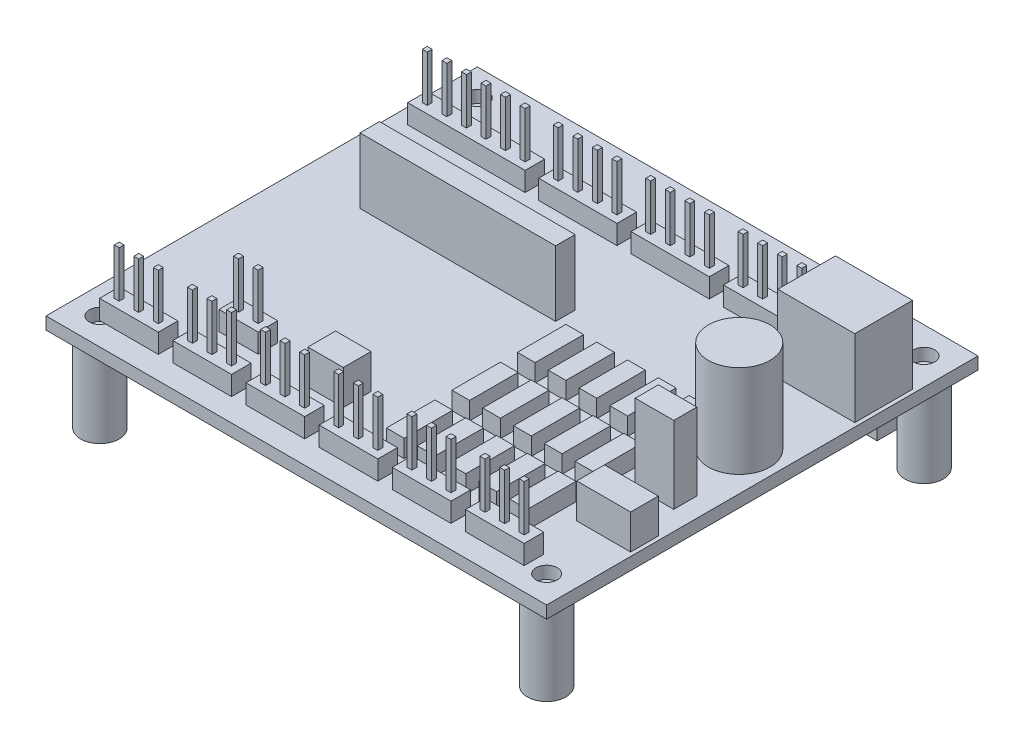
from build123d import *

# Parameters (mm, degrees)
SK_PCB_65X56_W                     = 65
SK_PCB_65X56_H                     = 56
SK_PCB_65X56_R                     = 1.375
PCB_65X56_DEPTH                    = 1.6
STANDOFFS_START                    = -11
SK_STANDOFFS_M2_5X11_R             = 2.5
STANDOFFS_M2_5X11_DEPTH            = 11
STANDOFFS_M2_5X11_2_DEPTH          = 11
STANDOFFS_M2_5X11_3_DEPTH          = 11
STANDOFFS_M2_5X11_4_DEPTH          = 11
GPIO_START                         = -8.5
SK_GPIO_FEMALE_HEADER_2X20_W       = 50.8
SK_GPIO_FEMALE_HEADER_2X20_H       = 5.1
GPIO_FEMALE_HEADER_2X20_DEPTH      = 8.5
BACK_START                         = 1.6
SK_BACK_HEADERS_J2_J6_J10_W        = 7.62
SK_BACK_HEADERS_J2_J6_J10_H        = 2.54
BACK_HEADERS_J2_J6_J10_DEPTH       = 2.5
BACK_HEADERS_J2_J6_J10_2_DEPTH     = 2.5
BACK_HEADERS_J2_J6_J10_3_DEPTH     = 2.5
BACK_HEADERS_J2_J6_J10_4_DEPTH     = 2.5
BACK_HEADERS_J2_J6_J10_5_DEPTH     = 2.5
BACK_HEADERS_J2_J6_J10_6_DEPTH     = 2.5
BACK_START_2                       = 4.1
SK_BACK_HEADER_PINS_W              = 0.64
SK_BACK_HEADER_PINS_H              = 0.64
BACK_HEADER_PINS_DEPTH             = 6
BACK_HEADER_PINS_2_DEPTH           = 6
BACK_HEADER_PINS_3_DEPTH           = 6
BACK_HEADER_PINS_4_DEPTH           = 6
BACK_HEADER_PINS_5_DEPTH           = 6
BACK_HEADER_PINS_6_DEPTH           = 6
BACK_HEADER_PINS_7_DEPTH           = 6
BACK_HEADER_PINS_8_DEPTH           = 6
BACK_HEADER_PINS_9_DEPTH           = 6
BACK_HEADER_PINS_10_DEPTH          = 6
BACK_HEADER_PINS_11_DEPTH          = 6
BACK_HEADER_PINS_12_DEPTH          = 6
BACK_HEADER_PINS_13_DEPTH          = 6
BACK_HEADER_PINS_14_DEPTH          = 6
BACK_HEADER_PINS_15_DEPTH          = 6
BACK_HEADER_PINS_16_DEPTH          = 6
BACK_HEADER_PINS_17_DEPTH          = 6
BACK_HEADER_PINS_18_DEPTH          = 6
FRONT_START                        = 1.6
SK_FRONT_HEADERS_J7_J8_J9_J11_W    = 15.24
SK_FRONT_HEADERS_J7_J8_J9_J11_H    = 2.54
FRONT_HEADERS_J7_J8_J9_J11_DEPTH   = 2.5
SK_FRONT_HEADERS_J7_J8_J9_J11_W_2  = 10.16
FRONT_HEADERS_J7_J8_J9_J11_2_DEPTH = 2.5
FRONT_HEADERS_J7_J8_J9_J11_3_DEPTH = 2.5
FRONT_HEADERS_J7_J8_J9_J11_4_DEPTH = 2.5
SK_FRONT_HEADERS_J7_J8_J9_J11_W_3  = 5.08
FRONT_HEADERS_J7_J8_J9_J11_5_DEPTH = 2.5
FRONT_START_2                      = 4.1
SK_FRONT_HEADER_PINS_W             = 0.64
SK_FRONT_HEADER_PINS_H             = 0.64
FRONT_HEADER_PINS_DEPTH            = 6
FRONT_HEADER_PINS_2_DEPTH          = 6
FRONT_HEADER_PINS_3_DEPTH          = 6
FRONT_HEADER_PINS_4_DEPTH          = 6
FRONT_HEADER_PINS_5_DEPTH          = 6
FRONT_HEADER_PINS_6_DEPTH          = 6
FRONT_HEADER_PINS_7_DEPTH          = 6
FRONT_HEADER_PINS_8_DEPTH          = 6
FRONT_HEADER_PINS_9_DEPTH          = 6
FRONT_HEADER_PINS_10_DEPTH         = 6
FRONT_HEADER_PINS_11_DEPTH         = 6
FRONT_HEADER_PINS_12_DEPTH         = 6
FRONT_HEADER_PINS_13_DEPTH         = 6
FRONT_HEADER_PINS_14_DEPTH         = 6
FRONT_HEADER_PINS_15_DEPTH         = 6
FRONT_HEADER_PINS_16_DEPTH         = 6
FRONT_HEADER_PINS_17_DEPTH         = 6
FRONT_HEADER_PINS_18_DEPTH         = 6
FRONT_HEADER_PINS_19_DEPTH         = 6
FRONT_HEADER_PINS_20_DEPTH         = 6
J1_START                           = 1.6
SK_J1_5V_SCREW_TERMINAL_W          = 10
SK_J1_5V_SCREW_TERMINAL_H          = 7.5
J1_5V_SCREW_TERMINAL_DEPTH         = 10
ADS1115_START                      = 1.6
SK_ADS1115_SOCKET_1X10_W           = 25.4
SK_ADS1115_SOCKET_1X10_H           = 2.54
ADS1115_SOCKET_1X10_DEPTH          = 8.5
RESISTORS_START                    = 1.6
SK_RESISTORS_R1_R15_W              = 2.3
SK_RESISTORS_R1_R15_H              = 6.3
RESISTORS_R1_R15_DEPTH             = 2.3
RESISTORS_R1_R15_2_DEPTH           = 2.3
RESISTORS_R1_R15_3_DEPTH           = 2.3
RESISTORS_R1_R15_4_DEPTH           = 2.3
RESISTORS_R1_R15_5_DEPTH           = 2.3
RESISTORS_R1_R15_6_DEPTH           = 2.3
RESISTORS_R1_R15_7_DEPTH           = 2.3
RESISTORS_R1_R15_8_DEPTH           = 2.3
RESISTORS_R1_R15_9_DEPTH           = 2.3
RESISTORS_R1_R15_10_DEPTH          = 2.3
RESISTORS_R1_R15_11_DEPTH          = 2.3
RESISTORS_R1_R15_12_DEPTH          = 2.3
RESISTORS_R1_R15_13_DEPTH          = 2.3
RESISTORS_R1_R15_14_DEPTH          = 2.3
RESISTORS_R1_R15_15_DEPTH          = 2.3
C1_START                           = 1.6
SK_C1_470UF_R                      = 4
C1_470UF_DEPTH                     = 12
F1_START                           = 1.6
SK_F1_PTC_2_5A_W                   = 5
SK_F1_PTC_2_5A_H                   = 3
F1_PTC_2_5A_DEPTH                  = 10
D1_START                           = 1.6
SK_D1_TVS_AND_Q1_BC557_W           = 7
SK_D1_TVS_AND_Q1_BC557_H           = 3.6
D1_TVS_AND_Q1_BC557_DEPTH          = 4.5
SK_D1_TVS_AND_Q1_BC557_W_2         = 4.6
D1_TVS_AND_Q1_BC557_2_DEPTH        = 4.5


with BuildPart() as part:
    # SK PCB 65x56 → PCB 65x56 (new body)
    with BuildSketch(Plane(origin=(0, 0, 0), x_dir=(1, 0, 0), z_dir=(0, 1, 0))):
        with Locations((32.5, 28)):
            Rectangle(SK_PCB_65X56_W, SK_PCB_65X56_H)
        with Locations(Location((3.5, 3.5, 0), (0, 0, 270))):
            Circle(SK_PCB_65X56_R, mode=Mode.SUBTRACT)
        with Locations(Location((61.5, 3.5, 0), (0, 0, 270))):
            Circle(SK_PCB_65X56_R, mode=Mode.SUBTRACT)
        with Locations(Location((3.5, 52.5, 0), (0, 0, 270))):
            Circle(SK_PCB_65X56_R, mode=Mode.SUBTRACT)
        with Locations(Location((61.5, 52.5, 0), (0, 0, 270))):
            Circle(SK_PCB_65X56_R, mode=Mode.SUBTRACT)
    extrude(amount=PCB_65X56_DEPTH)


with BuildPart() as body_2:
    # SK Standoffs M2.5x11 → Standoffs M2.5x11 (new body)
    with BuildSketch(Plane(origin=(0, 0, 0), x_dir=(1, 0, 0), z_dir=(0, 1, 0)).offset(STANDOFFS_START)):
        with Locations(Location((3.5, 3.5, 0), (0, 0, 270))):
            Circle(SK_STANDOFFS_M2_5X11_R)
    extrude(amount=STANDOFFS_M2_5X11_DEPTH)


with BuildPart() as body_3:
    # SK Standoffs M2.5x11 → Standoffs M2.5x11 2 (new body)
    with BuildSketch(Plane(origin=(0, 0, 0), x_dir=(1, 0, 0), z_dir=(0, 1, 0)).offset(STANDOFFS_START)):
        with Locations(Location((61.5, 3.5, 0), (0, 0, 270))):
            Circle(SK_STANDOFFS_M2_5X11_R)
    extrude(amount=STANDOFFS_M2_5X11_2_DEPTH)


with BuildPart() as body_4:
    # SK Standoffs M2.5x11 → Standoffs M2.5x11 3 (new body)
    with BuildSketch(Plane(origin=(0, 0, 0), x_dir=(1, 0, 0), z_dir=(0, 1, 0)).offset(STANDOFFS_START)):
        with Locations(Location((3.5, 52.5, 0), (0, 0, 270))):
            Circle(SK_STANDOFFS_M2_5X11_R)
    extrude(amount=STANDOFFS_M2_5X11_3_DEPTH)


with BuildPart() as body_5:
    # SK Standoffs M2.5x11 → Standoffs M2.5x11 4 (new body)
    with BuildSketch(Plane(origin=(0, 0, 0), x_dir=(1, 0, 0), z_dir=(0, 1, 0)).offset(STANDOFFS_START)):
        with Locations(Location((61.5, 52.5, 0), (0, 0, 270))):
            Circle(SK_STANDOFFS_M2_5X11_R)
    extrude(amount=STANDOFFS_M2_5X11_4_DEPTH)


with BuildPart() as body_6:
    # SK GPIO female header 2x20 → GPIO female header 2x20 (new body)
    with BuildSketch(Plane(origin=(0, 0, 0), x_dir=(1, 0, 0), z_dir=(0, 1, 0)).offset(GPIO_START)):
        with Locations((32.5, 52.55)):
            Rectangle(SK_GPIO_FEMALE_HEADER_2X20_W, SK_GPIO_FEMALE_HEADER_2X20_H)
    extrude(amount=GPIO_FEMALE_HEADER_2X20_DEPTH)


with BuildPart() as body_7:
    # SK Back headers J2-J6 J10 → Back headers J2-J6 J10 (new body)
    with BuildSketch(Plane(origin=(0, 0, 0), x_dir=(1, 0, 0), z_dir=(0, 1, 0)).offset(BACK_START)):
        with Locations((7.81, 4.23)):
            Rectangle(SK_BACK_HEADERS_J2_J6_J10_W, SK_BACK_HEADERS_J2_J6_J10_H)
    extrude(amount=BACK_HEADERS_J2_J6_J10_DEPTH)


with BuildPart() as body_8:
    # SK Back headers J2-J6 J10 → Back headers J2-J6 J10 2 (new body)
    with BuildSketch(Plane(origin=(0, 0, 0), x_dir=(1, 0, 0), z_dir=(0, 1, 0)).offset(BACK_START)):
        with Locations((17.31, 4.23)):
            Rectangle(SK_BACK_HEADERS_J2_J6_J10_W, SK_BACK_HEADERS_J2_J6_J10_H)
    extrude(amount=BACK_HEADERS_J2_J6_J10_2_DEPTH)


with BuildPart() as body_9:
    # SK Back headers J2-J6 J10 → Back headers J2-J6 J10 3 (new body)
    with BuildSketch(Plane(origin=(0, 0, 0), x_dir=(1, 0, 0), z_dir=(0, 1, 0)).offset(BACK_START)):
        with Locations((26.81, 4.23)):
            Rectangle(SK_BACK_HEADERS_J2_J6_J10_W, SK_BACK_HEADERS_J2_J6_J10_H)
    extrude(amount=BACK_HEADERS_J2_J6_J10_3_DEPTH)


with BuildPart() as body_10:
    # SK Back headers J2-J6 J10 → Back headers J2-J6 J10 4 (new body)
    with BuildSketch(Plane(origin=(0, 0, 0), x_dir=(1, 0, 0), z_dir=(0, 1, 0)).offset(BACK_START)):
        with Locations((36.31, 4.23)):
            Rectangle(SK_BACK_HEADERS_J2_J6_J10_W, SK_BACK_HEADERS_J2_J6_J10_H)
    extrude(amount=BACK_HEADERS_J2_J6_J10_4_DEPTH)


with BuildPart() as body_11:
    # SK Back headers J2-J6 J10 → Back headers J2-J6 J10 5 (new body)
    with BuildSketch(Plane(origin=(0, 0, 0), x_dir=(1, 0, 0), z_dir=(0, 1, 0)).offset(BACK_START)):
        with Locations((45.81, 4.23)):
            Rectangle(SK_BACK_HEADERS_J2_J6_J10_W, SK_BACK_HEADERS_J2_J6_J10_H)
    extrude(amount=BACK_HEADERS_J2_J6_J10_5_DEPTH)


with BuildPart() as body_12:
    # SK Back headers J2-J6 J10 → Back headers J2-J6 J10 6 (new body)
    with BuildSketch(Plane(origin=(0, 0, 0), x_dir=(1, 0, 0), z_dir=(0, 1, 0)).offset(BACK_START)):
        with Locations((55.31, 4.23)):
            Rectangle(SK_BACK_HEADERS_J2_J6_J10_W, SK_BACK_HEADERS_J2_J6_J10_H)
    extrude(amount=BACK_HEADERS_J2_J6_J10_6_DEPTH)


with BuildPart() as body_13:
    # SK Back header pins → Back header pins (new body)
    with BuildSketch(Plane(origin=(0, 0, 0), x_dir=(1, 0, 0), z_dir=(0, 1, 0)).offset(BACK_START_2)):
        with Locations((5.27, 4.23)):
            Rectangle(SK_BACK_HEADER_PINS_W, SK_BACK_HEADER_PINS_H)
    extrude(amount=BACK_HEADER_PINS_DEPTH)


with BuildPart() as body_14:
    # SK Back header pins → Back header pins 2 (new body)
    with BuildSketch(Plane(origin=(0, 0, 0), x_dir=(1, 0, 0), z_dir=(0, 1, 0)).offset(BACK_START_2)):
        with Locations((7.81, 4.23)):
            Rectangle(SK_BACK_HEADER_PINS_W, SK_BACK_HEADER_PINS_H)
    extrude(amount=BACK_HEADER_PINS_2_DEPTH)


with BuildPart() as body_15:
    # SK Back header pins → Back header pins 3 (new body)
    with BuildSketch(Plane(origin=(0, 0, 0), x_dir=(1, 0, 0), z_dir=(0, 1, 0)).offset(BACK_START_2)):
        with Locations((10.35, 4.23)):
            Rectangle(SK_BACK_HEADER_PINS_W, SK_BACK_HEADER_PINS_H)
    extrude(amount=BACK_HEADER_PINS_3_DEPTH)


with BuildPart() as body_16:
    # SK Back header pins → Back header pins 4 (new body)
    with BuildSketch(Plane(origin=(0, 0, 0), x_dir=(1, 0, 0), z_dir=(0, 1, 0)).offset(BACK_START_2)):
        with Locations((14.77, 4.23)):
            Rectangle(SK_BACK_HEADER_PINS_W, SK_BACK_HEADER_PINS_H)
    extrude(amount=BACK_HEADER_PINS_4_DEPTH)


with BuildPart() as body_17:
    # SK Back header pins → Back header pins 5 (new body)
    with BuildSketch(Plane(origin=(0, 0, 0), x_dir=(1, 0, 0), z_dir=(0, 1, 0)).offset(BACK_START_2)):
        with Locations((17.31, 4.23)):
            Rectangle(SK_BACK_HEADER_PINS_W, SK_BACK_HEADER_PINS_H)
    extrude(amount=BACK_HEADER_PINS_5_DEPTH)


with BuildPart() as body_18:
    # SK Back header pins → Back header pins 6 (new body)
    with BuildSketch(Plane(origin=(0, 0, 0), x_dir=(1, 0, 0), z_dir=(0, 1, 0)).offset(BACK_START_2)):
        with Locations((19.85, 4.23)):
            Rectangle(SK_BACK_HEADER_PINS_W, SK_BACK_HEADER_PINS_H)
    extrude(amount=BACK_HEADER_PINS_6_DEPTH)


with BuildPart() as body_19:
    # SK Back header pins → Back header pins 7 (new body)
    with BuildSketch(Plane(origin=(0, 0, 0), x_dir=(1, 0, 0), z_dir=(0, 1, 0)).offset(BACK_START_2)):
        with Locations((24.27, 4.23)):
            Rectangle(SK_BACK_HEADER_PINS_W, SK_BACK_HEADER_PINS_H)
    extrude(amount=BACK_HEADER_PINS_7_DEPTH)


with BuildPart() as body_20:
    # SK Back header pins → Back header pins 8 (new body)
    with BuildSketch(Plane(origin=(0, 0, 0), x_dir=(1, 0, 0), z_dir=(0, 1, 0)).offset(BACK_START_2)):
        with Locations((26.81, 4.23)):
            Rectangle(SK_BACK_HEADER_PINS_W, SK_BACK_HEADER_PINS_H)
    extrude(amount=BACK_HEADER_PINS_8_DEPTH)


with BuildPart() as body_21:
    # SK Back header pins → Back header pins 9 (new body)
    with BuildSketch(Plane(origin=(0, 0, 0), x_dir=(1, 0, 0), z_dir=(0, 1, 0)).offset(BACK_START_2)):
        with Locations((29.35, 4.23)):
            Rectangle(SK_BACK_HEADER_PINS_W, SK_BACK_HEADER_PINS_H)
    extrude(amount=BACK_HEADER_PINS_9_DEPTH)


with BuildPart() as body_22:
    # SK Back header pins → Back header pins 10 (new body)
    with BuildSketch(Plane(origin=(0, 0, 0), x_dir=(1, 0, 0), z_dir=(0, 1, 0)).offset(BACK_START_2)):
        with Locations((33.77, 4.23)):
            Rectangle(SK_BACK_HEADER_PINS_W, SK_BACK_HEADER_PINS_H)
    extrude(amount=BACK_HEADER_PINS_10_DEPTH)


with BuildPart() as body_23:
    # SK Back header pins → Back header pins 11 (new body)
    with BuildSketch(Plane(origin=(0, 0, 0), x_dir=(1, 0, 0), z_dir=(0, 1, 0)).offset(BACK_START_2)):
        with Locations((36.31, 4.23)):
            Rectangle(SK_BACK_HEADER_PINS_W, SK_BACK_HEADER_PINS_H)
    extrude(amount=BACK_HEADER_PINS_11_DEPTH)


with BuildPart() as body_24:
    # SK Back header pins → Back header pins 12 (new body)
    with BuildSketch(Plane(origin=(0, 0, 0), x_dir=(1, 0, 0), z_dir=(0, 1, 0)).offset(BACK_START_2)):
        with Locations((38.85, 4.23)):
            Rectangle(SK_BACK_HEADER_PINS_W, SK_BACK_HEADER_PINS_H)
    extrude(amount=BACK_HEADER_PINS_12_DEPTH)


with BuildPart() as body_25:
    # SK Back header pins → Back header pins 13 (new body)
    with BuildSketch(Plane(origin=(0, 0, 0), x_dir=(1, 0, 0), z_dir=(0, 1, 0)).offset(BACK_START_2)):
        with Locations((43.27, 4.23)):
            Rectangle(SK_BACK_HEADER_PINS_W, SK_BACK_HEADER_PINS_H)
    extrude(amount=BACK_HEADER_PINS_13_DEPTH)


with BuildPart() as body_26:
    # SK Back header pins → Back header pins 14 (new body)
    with BuildSketch(Plane(origin=(0, 0, 0), x_dir=(1, 0, 0), z_dir=(0, 1, 0)).offset(BACK_START_2)):
        with Locations((45.81, 4.23)):
            Rectangle(SK_BACK_HEADER_PINS_W, SK_BACK_HEADER_PINS_H)
    extrude(amount=BACK_HEADER_PINS_14_DEPTH)


with BuildPart() as body_27:
    # SK Back header pins → Back header pins 15 (new body)
    with BuildSketch(Plane(origin=(0, 0, 0), x_dir=(1, 0, 0), z_dir=(0, 1, 0)).offset(BACK_START_2)):
        with Locations((48.35, 4.23)):
            Rectangle(SK_BACK_HEADER_PINS_W, SK_BACK_HEADER_PINS_H)
    extrude(amount=BACK_HEADER_PINS_15_DEPTH)


with BuildPart() as body_28:
    # SK Back header pins → Back header pins 16 (new body)
    with BuildSketch(Plane(origin=(0, 0, 0), x_dir=(1, 0, 0), z_dir=(0, 1, 0)).offset(BACK_START_2)):
        with Locations((52.77, 4.23)):
            Rectangle(SK_BACK_HEADER_PINS_W, SK_BACK_HEADER_PINS_H)
    extrude(amount=BACK_HEADER_PINS_16_DEPTH)


with BuildPart() as body_29:
    # SK Back header pins → Back header pins 17 (new body)
    with BuildSketch(Plane(origin=(0, 0, 0), x_dir=(1, 0, 0), z_dir=(0, 1, 0)).offset(BACK_START_2)):
        with Locations((55.31, 4.23)):
            Rectangle(SK_BACK_HEADER_PINS_W, SK_BACK_HEADER_PINS_H)
    extrude(amount=BACK_HEADER_PINS_17_DEPTH)


with BuildPart() as body_30:
    # SK Back header pins → Back header pins 18 (new body)
    with BuildSketch(Plane(origin=(0, 0, 0), x_dir=(1, 0, 0), z_dir=(0, 1, 0)).offset(BACK_START_2)):
        with Locations((57.85, 4.23)):
            Rectangle(SK_BACK_HEADER_PINS_W, SK_BACK_HEADER_PINS_H)
    extrude(amount=BACK_HEADER_PINS_18_DEPTH)


with BuildPart() as body_31:
    # SK Front headers J7 J8 J9 J11 → Front headers J7 J8 J9 J11 (new body)
    with BuildSketch(Plane(origin=(0, 0, 0), x_dir=(1, 0, 0), z_dir=(0, 1, 0)).offset(FRONT_START)):
        with Locations((9.62, 46.23)):
            Rectangle(SK_FRONT_HEADERS_J7_J8_J9_J11_W, SK_FRONT_HEADERS_J7_J8_J9_J11_H)
    extrude(amount=FRONT_HEADERS_J7_J8_J9_J11_DEPTH)


with BuildPart() as body_32:
    # SK Front headers J7 J8 J9 J11 → Front headers J7 J8 J9 J11 2 (new body)
    with BuildSketch(Plane(origin=(0, 0, 0), x_dir=(1, 0, 0), z_dir=(0, 1, 0)).offset(FRONT_START)):
        with Locations((24.08, 46.23)):
            Rectangle(SK_FRONT_HEADERS_J7_J8_J9_J11_W_2, SK_FRONT_HEADERS_J7_J8_J9_J11_H)
    extrude(amount=FRONT_HEADERS_J7_J8_J9_J11_2_DEPTH)


with BuildPart() as body_33:
    # SK Front headers J7 J8 J9 J11 → Front headers J7 J8 J9 J11 3 (new body)
    with BuildSketch(Plane(origin=(0, 0, 0), x_dir=(1, 0, 0), z_dir=(0, 1, 0)).offset(FRONT_START)):
        with Locations((36.08, 46.23)):
            Rectangle(SK_FRONT_HEADERS_J7_J8_J9_J11_W_2, SK_FRONT_HEADERS_J7_J8_J9_J11_H)
    extrude(amount=FRONT_HEADERS_J7_J8_J9_J11_3_DEPTH)


with BuildPart() as body_34:
    # SK Front headers J7 J8 J9 J11 → Front headers J7 J8 J9 J11 4 (new body)
    with BuildSketch(Plane(origin=(0, 0, 0), x_dir=(1, 0, 0), z_dir=(0, 1, 0)).offset(FRONT_START)):
        with Locations((48.08, 46.23)):
            Rectangle(SK_FRONT_HEADERS_J7_J8_J9_J11_W_2, SK_FRONT_HEADERS_J7_J8_J9_J11_H)
    extrude(amount=FRONT_HEADERS_J7_J8_J9_J11_4_DEPTH)


with BuildPart() as body_35:
    # SK Front headers J7 J8 J9 J11 → Front headers J7 J8 J9 J11 5 (new body)
    with BuildSketch(Plane(origin=(0, 0, 0), x_dir=(1, 0, 0), z_dir=(0, 1, 0)).offset(FRONT_START)):
        with Locations((15.54, 10.73)):
            Rectangle(SK_FRONT_HEADERS_J7_J8_J9_J11_W_3, SK_FRONT_HEADERS_J7_J8_J9_J11_H)
    extrude(amount=FRONT_HEADERS_J7_J8_J9_J11_5_DEPTH)


with BuildPart() as body_36:
    # SK Front header pins → Front header pins (new body)
    with BuildSketch(Plane(origin=(0, 0, 0), x_dir=(1, 0, 0), z_dir=(0, 1, 0)).offset(FRONT_START_2)):
        with Locations((3.27, 46.23)):
            Rectangle(SK_FRONT_HEADER_PINS_W, SK_FRONT_HEADER_PINS_H)
    extrude(amount=FRONT_HEADER_PINS_DEPTH)


with BuildPart() as body_37:
    # SK Front header pins → Front header pins 2 (new body)
    with BuildSketch(Plane(origin=(0, 0, 0), x_dir=(1, 0, 0), z_dir=(0, 1, 0)).offset(FRONT_START_2)):
        with Locations((5.81, 46.23)):
            Rectangle(SK_FRONT_HEADER_PINS_W, SK_FRONT_HEADER_PINS_H)
    extrude(amount=FRONT_HEADER_PINS_2_DEPTH)


with BuildPart() as body_38:
    # SK Front header pins → Front header pins 3 (new body)
    with BuildSketch(Plane(origin=(0, 0, 0), x_dir=(1, 0, 0), z_dir=(0, 1, 0)).offset(FRONT_START_2)):
        with Locations((8.35, 46.23)):
            Rectangle(SK_FRONT_HEADER_PINS_W, SK_FRONT_HEADER_PINS_H)
    extrude(amount=FRONT_HEADER_PINS_3_DEPTH)


with BuildPart() as body_39:
    # SK Front header pins → Front header pins 4 (new body)
    with BuildSketch(Plane(origin=(0, 0, 0), x_dir=(1, 0, 0), z_dir=(0, 1, 0)).offset(FRONT_START_2)):
        with Locations((10.89, 46.23)):
            Rectangle(SK_FRONT_HEADER_PINS_W, SK_FRONT_HEADER_PINS_H)
    extrude(amount=FRONT_HEADER_PINS_4_DEPTH)


with BuildPart() as body_40:
    # SK Front header pins → Front header pins 5 (new body)
    with BuildSketch(Plane(origin=(0, 0, 0), x_dir=(1, 0, 0), z_dir=(0, 1, 0)).offset(FRONT_START_2)):
        with Locations((13.43, 46.23)):
            Rectangle(SK_FRONT_HEADER_PINS_W, SK_FRONT_HEADER_PINS_H)
    extrude(amount=FRONT_HEADER_PINS_5_DEPTH)


with BuildPart() as body_41:
    # SK Front header pins → Front header pins 6 (new body)
    with BuildSketch(Plane(origin=(0, 0, 0), x_dir=(1, 0, 0), z_dir=(0, 1, 0)).offset(FRONT_START_2)):
        with Locations((15.97, 46.23)):
            Rectangle(SK_FRONT_HEADER_PINS_W, SK_FRONT_HEADER_PINS_H)
    extrude(amount=FRONT_HEADER_PINS_6_DEPTH)


with BuildPart() as body_42:
    # SK Front header pins → Front header pins 7 (new body)
    with BuildSketch(Plane(origin=(0, 0, 0), x_dir=(1, 0, 0), z_dir=(0, 1, 0)).offset(FRONT_START_2)):
        with Locations((20.27, 46.23)):
            Rectangle(SK_FRONT_HEADER_PINS_W, SK_FRONT_HEADER_PINS_H)
    extrude(amount=FRONT_HEADER_PINS_7_DEPTH)


with BuildPart() as body_43:
    # SK Front header pins → Front header pins 8 (new body)
    with BuildSketch(Plane(origin=(0, 0, 0), x_dir=(1, 0, 0), z_dir=(0, 1, 0)).offset(FRONT_START_2)):
        with Locations((22.81, 46.23)):
            Rectangle(SK_FRONT_HEADER_PINS_W, SK_FRONT_HEADER_PINS_H)
    extrude(amount=FRONT_HEADER_PINS_8_DEPTH)


with BuildPart() as body_44:
    # SK Front header pins → Front header pins 9 (new body)
    with BuildSketch(Plane(origin=(0, 0, 0), x_dir=(1, 0, 0), z_dir=(0, 1, 0)).offset(FRONT_START_2)):
        with Locations((25.35, 46.23)):
            Rectangle(SK_FRONT_HEADER_PINS_W, SK_FRONT_HEADER_PINS_H)
    extrude(amount=FRONT_HEADER_PINS_9_DEPTH)


with BuildPart() as body_45:
    # SK Front header pins → Front header pins 10 (new body)
    with BuildSketch(Plane(origin=(0, 0, 0), x_dir=(1, 0, 0), z_dir=(0, 1, 0)).offset(FRONT_START_2)):
        with Locations((27.89, 46.23)):
            Rectangle(SK_FRONT_HEADER_PINS_W, SK_FRONT_HEADER_PINS_H)
    extrude(amount=FRONT_HEADER_PINS_10_DEPTH)


with BuildPart() as body_46:
    # SK Front header pins → Front header pins 11 (new body)
    with BuildSketch(Plane(origin=(0, 0, 0), x_dir=(1, 0, 0), z_dir=(0, 1, 0)).offset(FRONT_START_2)):
        with Locations((32.27, 46.23)):
            Rectangle(SK_FRONT_HEADER_PINS_W, SK_FRONT_HEADER_PINS_H)
    extrude(amount=FRONT_HEADER_PINS_11_DEPTH)


with BuildPart() as body_47:
    # SK Front header pins → Front header pins 12 (new body)
    with BuildSketch(Plane(origin=(0, 0, 0), x_dir=(1, 0, 0), z_dir=(0, 1, 0)).offset(FRONT_START_2)):
        with Locations((34.81, 46.23)):
            Rectangle(SK_FRONT_HEADER_PINS_W, SK_FRONT_HEADER_PINS_H)
    extrude(amount=FRONT_HEADER_PINS_12_DEPTH)


with BuildPart() as body_48:
    # SK Front header pins → Front header pins 13 (new body)
    with BuildSketch(Plane(origin=(0, 0, 0), x_dir=(1, 0, 0), z_dir=(0, 1, 0)).offset(FRONT_START_2)):
        with Locations((37.35, 46.23)):
            Rectangle(SK_FRONT_HEADER_PINS_W, SK_FRONT_HEADER_PINS_H)
    extrude(amount=FRONT_HEADER_PINS_13_DEPTH)


with BuildPart() as body_49:
    # SK Front header pins → Front header pins 14 (new body)
    with BuildSketch(Plane(origin=(0, 0, 0), x_dir=(1, 0, 0), z_dir=(0, 1, 0)).offset(FRONT_START_2)):
        with Locations((39.89, 46.23)):
            Rectangle(SK_FRONT_HEADER_PINS_W, SK_FRONT_HEADER_PINS_H)
    extrude(amount=FRONT_HEADER_PINS_14_DEPTH)


with BuildPart() as body_50:
    # SK Front header pins → Front header pins 15 (new body)
    with BuildSketch(Plane(origin=(0, 0, 0), x_dir=(1, 0, 0), z_dir=(0, 1, 0)).offset(FRONT_START_2)):
        with Locations((44.27, 46.23)):
            Rectangle(SK_FRONT_HEADER_PINS_W, SK_FRONT_HEADER_PINS_H)
    extrude(amount=FRONT_HEADER_PINS_15_DEPTH)


with BuildPart() as body_51:
    # SK Front header pins → Front header pins 16 (new body)
    with BuildSketch(Plane(origin=(0, 0, 0), x_dir=(1, 0, 0), z_dir=(0, 1, 0)).offset(FRONT_START_2)):
        with Locations((46.81, 46.23)):
            Rectangle(SK_FRONT_HEADER_PINS_W, SK_FRONT_HEADER_PINS_H)
    extrude(amount=FRONT_HEADER_PINS_16_DEPTH)


with BuildPart() as body_52:
    # SK Front header pins → Front header pins 17 (new body)
    with BuildSketch(Plane(origin=(0, 0, 0), x_dir=(1, 0, 0), z_dir=(0, 1, 0)).offset(FRONT_START_2)):
        with Locations((49.35, 46.23)):
            Rectangle(SK_FRONT_HEADER_PINS_W, SK_FRONT_HEADER_PINS_H)
    extrude(amount=FRONT_HEADER_PINS_17_DEPTH)


with BuildPart() as body_53:
    # SK Front header pins → Front header pins 18 (new body)
    with BuildSketch(Plane(origin=(0, 0, 0), x_dir=(1, 0, 0), z_dir=(0, 1, 0)).offset(FRONT_START_2)):
        with Locations((51.89, 46.23)):
            Rectangle(SK_FRONT_HEADER_PINS_W, SK_FRONT_HEADER_PINS_H)
    extrude(amount=FRONT_HEADER_PINS_18_DEPTH)


with BuildPart() as body_54:
    # SK Front header pins → Front header pins 19 (new body)
    with BuildSketch(Plane(origin=(0, 0, 0), x_dir=(1, 0, 0), z_dir=(0, 1, 0)).offset(FRONT_START_2)):
        with Locations((14.27, 10.73)):
            Rectangle(SK_FRONT_HEADER_PINS_W, SK_FRONT_HEADER_PINS_H)
    extrude(amount=FRONT_HEADER_PINS_19_DEPTH)


with BuildPart() as body_55:
    # SK Front header pins → Front header pins 20 (new body)
    with BuildSketch(Plane(origin=(0, 0, 0), x_dir=(1, 0, 0), z_dir=(0, 1, 0)).offset(FRONT_START_2)):
        with Locations((16.81, 10.73)):
            Rectangle(SK_FRONT_HEADER_PINS_W, SK_FRONT_HEADER_PINS_H)
    extrude(amount=FRONT_HEADER_PINS_20_DEPTH)


with BuildPart() as body_56:
    # SK J1 5V screw terminal → J1 5V screw terminal (new body)
    with BuildSketch(Plane(origin=(0, 0, 0), x_dir=(1, 0, 0), z_dir=(0, 1, 0)).offset(J1_START)):
        with Locations((59.5, 44.25)):
            Rectangle(SK_J1_5V_SCREW_TERMINAL_W, SK_J1_5V_SCREW_TERMINAL_H)
    extrude(amount=J1_5V_SCREW_TERMINAL_DEPTH)


with BuildPart() as body_57:
    # SK ADS1115 socket 1x10 → ADS1115 socket 1x10 (new body)
    with BuildSketch(Plane(origin=(0, 0, 0), x_dir=(1, 0, 0), z_dir=(0, 1, 0)).offset(ADS1115_START)):
        with Locations((21, 33.73)):
            Rectangle(SK_ADS1115_SOCKET_1X10_W, SK_ADS1115_SOCKET_1X10_H)
    extrude(amount=ADS1115_SOCKET_1X10_DEPTH)


with BuildPart() as body_58:
    # SK Resistors R1-R15 → Resistors R1-R15 (new body)
    with BuildSketch(Plane(origin=(0, 0, 0), x_dir=(1, 0, 0), z_dir=(0, 1, 0)).offset(RESISTORS_START)):
        with Locations((38.15, 27.35)):
            Rectangle(SK_RESISTORS_R1_R15_W, SK_RESISTORS_R1_R15_H)
    extrude(amount=RESISTORS_R1_R15_DEPTH)


with BuildPart() as body_59:
    # SK Resistors R1-R15 → Resistors R1-R15 2 (new body)
    with BuildSketch(Plane(origin=(0, 0, 0), x_dir=(1, 0, 0), z_dir=(0, 1, 0)).offset(RESISTORS_START)):
        with Locations((42.15, 27.35)):
            Rectangle(SK_RESISTORS_R1_R15_W, SK_RESISTORS_R1_R15_H)
    extrude(amount=RESISTORS_R1_R15_2_DEPTH)


with BuildPart() as body_60:
    # SK Resistors R1-R15 → Resistors R1-R15 3 (new body)
    with BuildSketch(Plane(origin=(0, 0, 0), x_dir=(1, 0, 0), z_dir=(0, 1, 0)).offset(RESISTORS_START)):
        with Locations((46.15, 27.35)):
            Rectangle(SK_RESISTORS_R1_R15_W, SK_RESISTORS_R1_R15_H)
    extrude(amount=RESISTORS_R1_R15_3_DEPTH)


with BuildPart() as body_61:
    # SK Resistors R1-R15 → Resistors R1-R15 4 (new body)
    with BuildSketch(Plane(origin=(0, 0, 0), x_dir=(1, 0, 0), z_dir=(0, 1, 0)).offset(RESISTORS_START)):
        with Locations((50.15, 27.35)):
            Rectangle(SK_RESISTORS_R1_R15_W, SK_RESISTORS_R1_R15_H)
    extrude(amount=RESISTORS_R1_R15_4_DEPTH)


with BuildPart() as body_62:
    # SK Resistors R1-R15 → Resistors R1-R15 5 (new body)
    with BuildSketch(Plane(origin=(0, 0, 0), x_dir=(1, 0, 0), z_dir=(0, 1, 0)).offset(RESISTORS_START)):
        with Locations((54.15, 27.35)):
            Rectangle(SK_RESISTORS_R1_R15_W, SK_RESISTORS_R1_R15_H)
    extrude(amount=RESISTORS_R1_R15_5_DEPTH)


with BuildPart() as body_63:
    # SK Resistors R1-R15 → Resistors R1-R15 6 (new body)
    with BuildSketch(Plane(origin=(0, 0, 0), x_dir=(1, 0, 0), z_dir=(0, 1, 0)).offset(RESISTORS_START)):
        with Locations((38.15, 18.85)):
            Rectangle(SK_RESISTORS_R1_R15_W, SK_RESISTORS_R1_R15_H)
    extrude(amount=RESISTORS_R1_R15_6_DEPTH)


with BuildPart() as body_64:
    # SK Resistors R1-R15 → Resistors R1-R15 7 (new body)
    with BuildSketch(Plane(origin=(0, 0, 0), x_dir=(1, 0, 0), z_dir=(0, 1, 0)).offset(RESISTORS_START)):
        with Locations((42.15, 18.85)):
            Rectangle(SK_RESISTORS_R1_R15_W, SK_RESISTORS_R1_R15_H)
    extrude(amount=RESISTORS_R1_R15_7_DEPTH)


with BuildPart() as body_65:
    # SK Resistors R1-R15 → Resistors R1-R15 8 (new body)
    with BuildSketch(Plane(origin=(0, 0, 0), x_dir=(1, 0, 0), z_dir=(0, 1, 0)).offset(RESISTORS_START)):
        with Locations((46.15, 18.85)):
            Rectangle(SK_RESISTORS_R1_R15_W, SK_RESISTORS_R1_R15_H)
    extrude(amount=RESISTORS_R1_R15_8_DEPTH)


with BuildPart() as body_66:
    # SK Resistors R1-R15 → Resistors R1-R15 9 (new body)
    with BuildSketch(Plane(origin=(0, 0, 0), x_dir=(1, 0, 0), z_dir=(0, 1, 0)).offset(RESISTORS_START)):
        with Locations((50.15, 18.85)):
            Rectangle(SK_RESISTORS_R1_R15_W, SK_RESISTORS_R1_R15_H)
    extrude(amount=RESISTORS_R1_R15_9_DEPTH)


with BuildPart() as body_67:
    # SK Resistors R1-R15 → Resistors R1-R15 10 (new body)
    with BuildSketch(Plane(origin=(0, 0, 0), x_dir=(1, 0, 0), z_dir=(0, 1, 0)).offset(RESISTORS_START)):
        with Locations((54.15, 18.85)):
            Rectangle(SK_RESISTORS_R1_R15_W, SK_RESISTORS_R1_R15_H)
    extrude(amount=RESISTORS_R1_R15_10_DEPTH)


with BuildPart() as body_68:
    # SK Resistors R1-R15 → Resistors R1-R15 11 (new body)
    with BuildSketch(Plane(origin=(0, 0, 0), x_dir=(1, 0, 0), z_dir=(0, 1, 0)).offset(RESISTORS_START)):
        with Locations((38.15, 10.35)):
            Rectangle(SK_RESISTORS_R1_R15_W, SK_RESISTORS_R1_R15_H)
    extrude(amount=RESISTORS_R1_R15_11_DEPTH)


with BuildPart() as body_69:
    # SK Resistors R1-R15 → Resistors R1-R15 12 (new body)
    with BuildSketch(Plane(origin=(0, 0, 0), x_dir=(1, 0, 0), z_dir=(0, 1, 0)).offset(RESISTORS_START)):
        with Locations((42.15, 10.35)):
            Rectangle(SK_RESISTORS_R1_R15_W, SK_RESISTORS_R1_R15_H)
    extrude(amount=RESISTORS_R1_R15_12_DEPTH)


with BuildPart() as body_70:
    # SK Resistors R1-R15 → Resistors R1-R15 13 (new body)
    with BuildSketch(Plane(origin=(0, 0, 0), x_dir=(1, 0, 0), z_dir=(0, 1, 0)).offset(RESISTORS_START)):
        with Locations((46.15, 10.35)):
            Rectangle(SK_RESISTORS_R1_R15_W, SK_RESISTORS_R1_R15_H)
    extrude(amount=RESISTORS_R1_R15_13_DEPTH)


with BuildPart() as body_71:
    # SK Resistors R1-R15 → Resistors R1-R15 14 (new body)
    with BuildSketch(Plane(origin=(0, 0, 0), x_dir=(1, 0, 0), z_dir=(0, 1, 0)).offset(RESISTORS_START)):
        with Locations((50.15, 10.35)):
            Rectangle(SK_RESISTORS_R1_R15_W, SK_RESISTORS_R1_R15_H)
    extrude(amount=RESISTORS_R1_R15_14_DEPTH)


with BuildPart() as body_72:
    # SK Resistors R1-R15 → Resistors R1-R15 15 (new body)
    with BuildSketch(Plane(origin=(0, 0, 0), x_dir=(1, 0, 0), z_dir=(0, 1, 0)).offset(RESISTORS_START)):
        with Locations((54.15, 10.35)):
            Rectangle(SK_RESISTORS_R1_R15_W, SK_RESISTORS_R1_R15_H)
    extrude(amount=RESISTORS_R1_R15_15_DEPTH)


with BuildPart() as body_73:
    # SK C1 470uF → C1 470uF (new body)
    with BuildSketch(Plane(origin=(0, 0, 0), x_dir=(1, 0, 0), z_dir=(0, 1, 0)).offset(C1_START)):
        with Locations(Location((60, 30, 0), (0, 0, 270))):
            Circle(SK_C1_470UF_R)
    extrude(amount=C1_470UF_DEPTH)


with BuildPart() as body_74:
    # SK F1 PTC 2.5A → F1 PTC 2.5A (new body)
    with BuildSketch(Plane(origin=(0, 0, 0), x_dir=(1, 0, 0), z_dir=(0, 1, 0)).offset(F1_START)):
        with Locations((60, 20.5)):
            Rectangle(SK_F1_PTC_2_5A_W, SK_F1_PTC_2_5A_H)
    extrude(amount=F1_PTC_2_5A_DEPTH)


with BuildPart() as body_75:
    # SK D1 TVS and Q1 BC557 → D1 TVS and Q1 BC557 (new body)
    with BuildSketch(Plane(origin=(0, 0, 0), x_dir=(1, 0, 0), z_dir=(0, 1, 0)).offset(D1_START)):
        with Locations((61, 13.2)):
            Rectangle(SK_D1_TVS_AND_Q1_BC557_W, SK_D1_TVS_AND_Q1_BC557_H)
    extrude(amount=D1_TVS_AND_Q1_BC557_DEPTH)


with BuildPart() as body_76:
    # SK D1 TVS and Q1 BC557 → D1 TVS and Q1 BC557 2 (new body)
    with BuildSketch(Plane(origin=(0, 0, 0), x_dir=(1, 0, 0), z_dir=(0, 1, 0)).offset(D1_START)):
        with Locations((27.3, 10.8)):
            Rectangle(SK_D1_TVS_AND_Q1_BC557_W_2, SK_D1_TVS_AND_Q1_BC557_H)
    extrude(amount=D1_TVS_AND_Q1_BC557_2_DEPTH)


solid = Compound([part.part, body_2.part, body_3.part, body_4.part, body_5.part, body_6.part, body_7.part, body_8.part, body_9.part, body_10.part, body_11.part, body_12.part, body_13.part, body_14.part, body_15.part, body_16.part, body_17.part, body_18.part, body_19.part, body_20.part, body_21.part, body_22.part, body_23.part, body_24.part, body_25.part, body_26.part, body_27.part, body_28.part, body_29.part, body_30.part, body_31.part, body_32.part, body_33.part, body_34.part, body_35.part, body_36.part, body_37.part, body_38.part, body_39.part, body_40.part, body_41.part, body_42.part, body_43.part, body_44.part, body_45.part, body_46.part, body_47.part, body_48.part, body_49.part, body_50.part, body_51.part, body_52.part, body_53.part, body_54.part, body_55.part, body_56.part, body_57.part, body_58.part, body_59.part, body_60.part, body_61.part, body_62.part, body_63.part, body_64.part, body_65.part, body_66.part, body_67.part, body_68.part, body_69.part, body_70.part, body_71.part, body_72.part, body_73.part, body_74.part, body_75.part, body_76.part])
